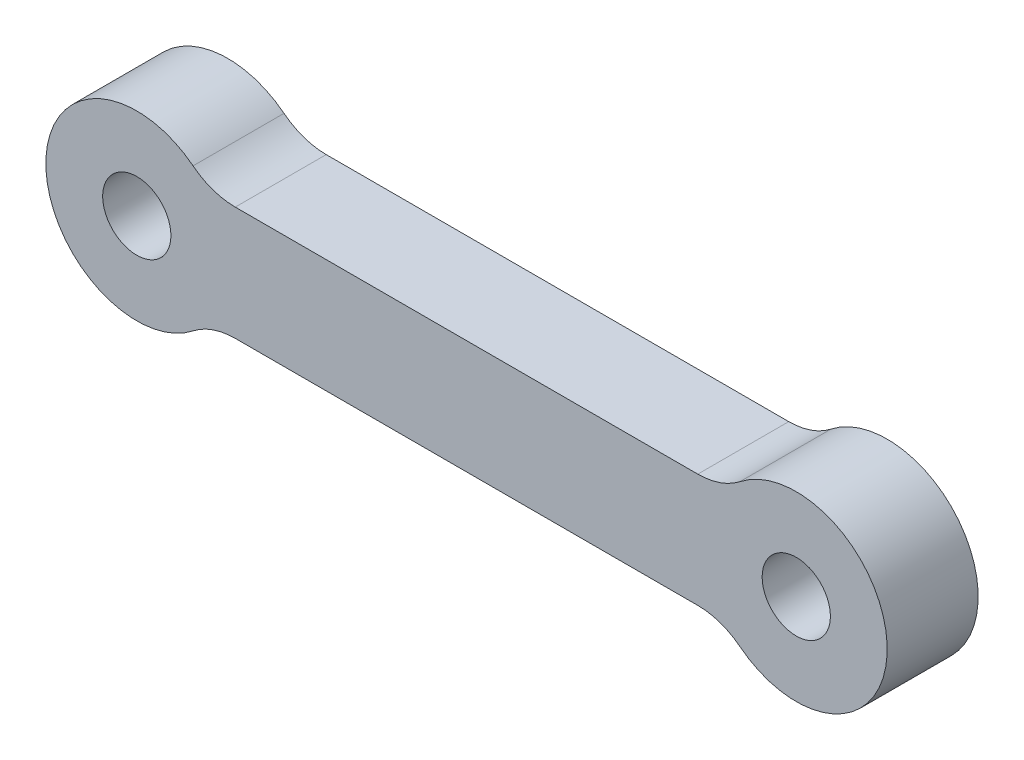
from build123d import *

# Parameters (mm, degrees)
SKETCH1_R           = 1.5
BOSS_EXTRUDE1_DEPTH = 4


with BuildPart() as part:
    # Sketch1 → Boss-Extrude1 (new body)
    with BuildSketch(Plane.XY):
        with BuildLine():
            Line((-10.169872981, -2.5), (10.169872981, -2.5))
            ThreePointArc((10.169872981, -2.5), (11.151853487, -2.665266452), (12.025641703, -3.142857143))
            ThreePointArc((12.025641703, -3.142857143), (18.5, 0), (12.025641703, 3.142857143))
            ThreePointArc((12.025641703, 3.142857143), (11.151853487, 2.665266452), (10.169872981, 2.5))
            Line((10.169872981, 2.5), (-10.169872981, 2.5))
            ThreePointArc((-10.169872981, 2.5), (-11.151853487, 2.665266452), (-12.025641703, 3.142857143))
            ThreePointArc((-12.025641703, 3.142857143), (-18.5, 0), (-12.025641703, -3.142857143))
            ThreePointArc((-12.025641703, -3.142857143), (-11.151853487, -2.665266452), (-10.169872981, -2.5))
        make_face()
        with Locations((-14.5, 0)):
            Circle(SKETCH1_R, mode=Mode.SUBTRACT)
        with Locations(Location((14.5, 0, 0), (0, 0, 180))):
            Circle(SKETCH1_R, mode=Mode.SUBTRACT)
    extrude(amount=BOSS_EXTRUDE1_DEPTH)


solid = part.part
